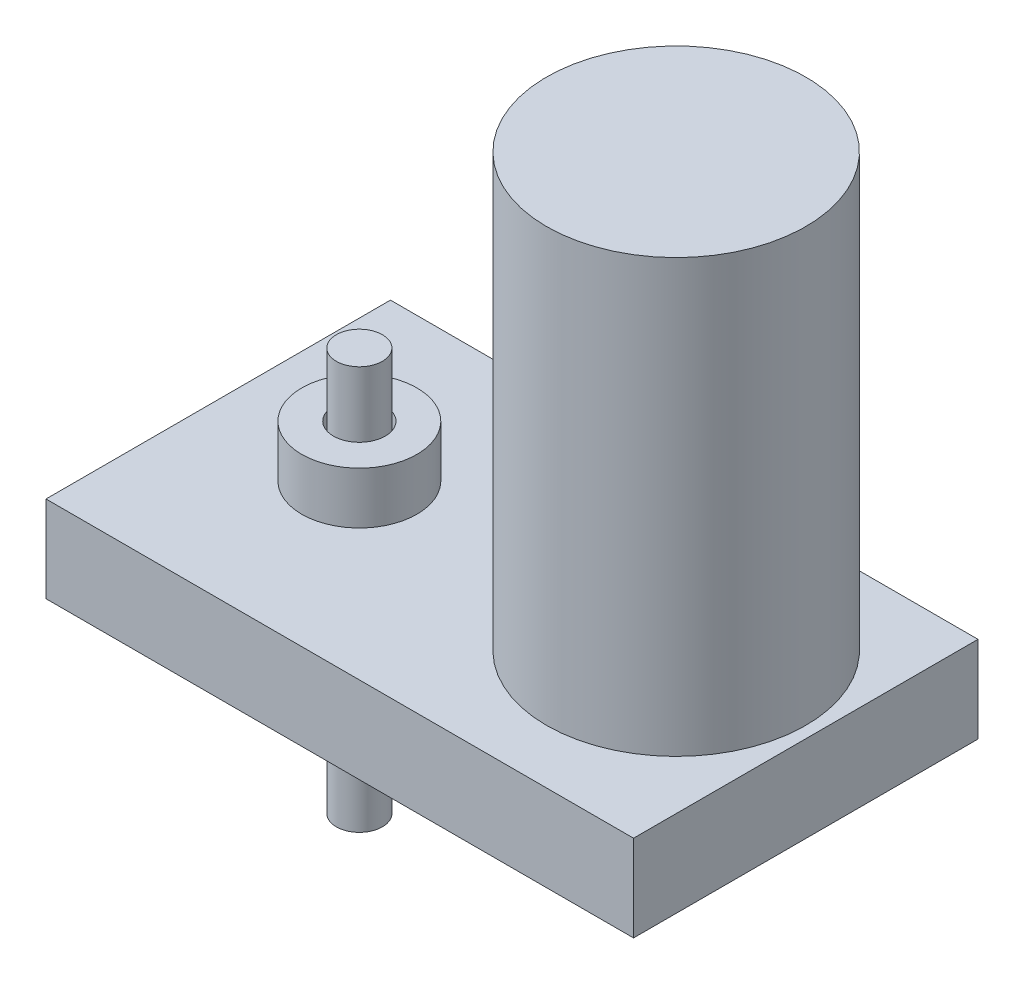
from build123d import *

# Parameters (mm, degrees)
SKETCH1_W           = 102
SKETCH1_H           = 59.8
SKETCH1_R           = 4
BOSS_EXTRUDE1_DEPTH = 15
SKETCH3_R           = 5
BOSS_EXTRUDE3_DEPTH = 2
SKETCH4_R           = 22.5
BOSS_EXTRUDE4_DEPTH = 75
SKETCH5_R           = 10
BOSS_EXTRUDE5_DEPTH = 9
SKETCH6_R           = 4.5
CUT_EXTRUDE1_DEPTH  = 9
SKETCH7_R           = 4
BOSS_EXTRUDE6_DEPTH = 20
SKETCH8_R           = 10
SKETCH8_R_2         = 4.5
BOSS_EXTRUDE7_DEPTH = 10
SKETCH9_R           = 4
BOSS_EXTRUDE8_DEPTH = 35


with BuildPart() as part:
    # Sketch1 → Boss-Extrude1 (new body)
    with BuildSketch(Plane(origin=(0, 0, 0), x_dir=(1, 0, 0), z_dir=(0, 1, 0))):
        Rectangle(SKETCH1_W, SKETCH1_H)
        with Locations(Location((-26.5, 0, 0), (0, 0, 270))):
            Circle(SKETCH1_R, mode=Mode.SUBTRACT)
    extrude(amount=BOSS_EXTRUDE1_DEPTH)

    # Sketch3 → Boss-Extrude3 (add)
    with BuildSketch(Plane(origin=(0, 15, 0), x_dir=(1, 0, 0), z_dir=(0, 1, 0))):
        with Locations(Location((28.5, 0, 0), (0, 0, 270))):
            Circle(SKETCH3_R)
    extrude(amount=BOSS_EXTRUDE3_DEPTH)

    # Sketch4 → Boss-Extrude4 (add)
    with BuildSketch(Plane(origin=(0, 17, 0), x_dir=(1, 0, 0), z_dir=(0, 1, 0))):
        with Locations(Location((28.5, 0, 0), (0, 0, 270))):
            Circle(SKETCH4_R)
    extrude(amount=BOSS_EXTRUDE4_DEPTH)

    # Sketch5 → Boss-Extrude5 (add)
    with BuildSketch(Plane(origin=(0, 15, 0), x_dir=(1, 0, 0), z_dir=(0, 1, 0))):
        with Locations(Location((-26.5, 0, 0), (0, 0, 270))):
            Circle(SKETCH5_R)
    extrude(amount=BOSS_EXTRUDE5_DEPTH)

    # Sketch6 → Cut-Extrude1 (cut)
    with BuildSketch(Plane(origin=(0, 24, 0), x_dir=(1, 0, 0), z_dir=(0, 1, 0))):
        with Locations(Location((-26.5, 0, 0), (0, 0, 270))):
            Circle(SKETCH6_R)
    extrude(amount=-CUT_EXTRUDE1_DEPTH, mode=Mode.SUBTRACT)

    # Sketch8 → Boss-Extrude7 (add)
    with BuildSketch(Plane.XZ):
        with Locations(Location((-26.5, 0, 0), (0, 0, 90))):
            Circle(SKETCH8_R)
        with Locations(Location((-26.5, 0, 0), (0, 0, 90))):
            Circle(SKETCH8_R_2, mode=Mode.SUBTRACT)
    extrude(amount=BOSS_EXTRUDE7_DEPTH)


with BuildPart() as body_2:
    # Sketch7 → Boss-Extrude6 (new body)
    with BuildSketch(Plane(origin=(0, 15, 0), x_dir=(1, 0, 0), z_dir=(0, 1, 0))):
        with Locations(Location((-26.5, 0, 0), (0, 0, 270))):
            Circle(SKETCH7_R)
    extrude(amount=BOSS_EXTRUDE6_DEPTH)


with BuildPart() as body_3:
    # Sketch9 → Boss-Extrude8 (new body)
    with BuildSketch(Plane.XZ):
        with Locations(Location((-26.5, 0, 0), (0, 0, 270))):
            Circle(SKETCH9_R)
    extrude(amount=BOSS_EXTRUDE8_DEPTH)


solid = Compound([part.part, body_2.part, body_3.part])
